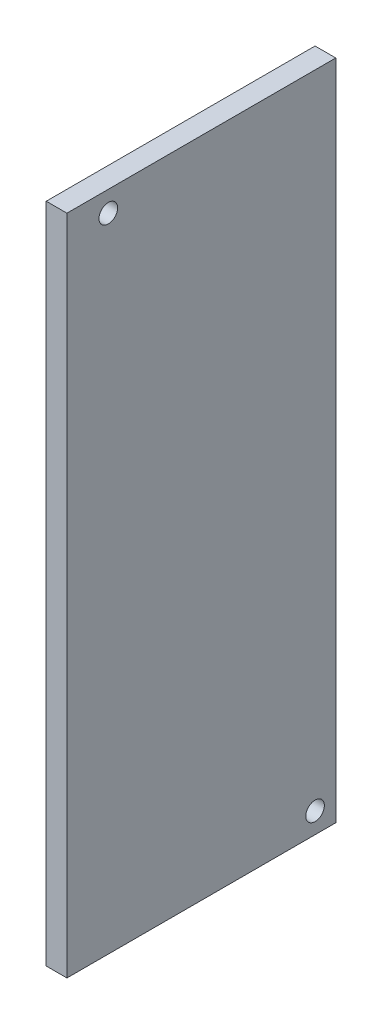
from build123d import *

# Parameters (mm, degrees)
SKETCH1_W               = 160
SKETCH1_H               = 64.94
BOSS_EXTRUDE1_DEPTH     = 5
CUT_EXTRUDE1_DEPTH      = 87.482951499
CUT_EXTRUDE1_DEPTH_BACK = 87.482951499
SKETCH2_R               = 2.25


with BuildPart() as part:
    # Sketch1 → Boss-Extrude1 (new body)
    with BuildSketch(Plane.YZ):
        Rectangle(SKETCH1_W, SKETCH1_H)
    extrude(amount=BOSS_EXTRUDE1_DEPTH)

    # Sketch2 → Cut-Extrude1 (cut, two sides: drawn at the far end of the back side and taken through both)
    with BuildSketch(Plane.YZ.offset(5).offset(-CUT_EXTRUDE1_DEPTH_BACK)):
        with Locations(Location((-75, -27.47, 0), (0, 0, 270))):
            Circle(SKETCH2_R)
        with Locations(Location((75, 22.47, 0), (0, 0, 270))):
            Circle(SKETCH2_R)
    extrude(amount=CUT_EXTRUDE1_DEPTH + CUT_EXTRUDE1_DEPTH_BACK, mode=Mode.SUBTRACT)


solid = part.part
